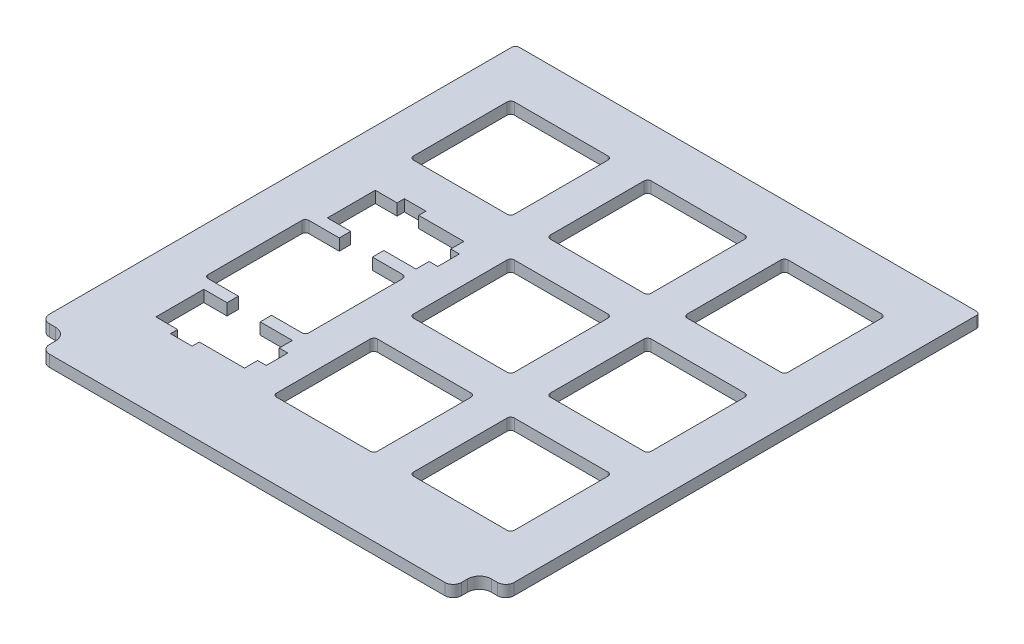
from build123d import *

# Parameters (mm, degrees)
EXTRUDE_1_DEPTH                = 1.6
CUT_EXTRUDE_1_REACH            = 82.345
SKETCH_2_W                     = 14
SKETCH_2_H                     = 14
FILLET_1_R                     = 0.5
PATTERN_LINEAR_2_COUNT         = 3
PATTERN_LINEAR_2_PITCH         = 19
PATTERN_LINEAR_2_COUNT_DIR2    = 3
PATTERN_LINEAR_2_PITCH_DIR2    = 19
FILLET_1_OF_PATTERN_LINEAR_2_R = 0.5
CUT_EXTRUDE_3_DEPTH            = 1.6
FILLET_2_R                     = 0.5


with BuildPart() as part:
    # 草图1 → 凸台-拉伸1 (new body)
    with BuildSketch(Plane(origin=(0, 0, 0), x_dir=(1, 0, 0), z_dir=(0, 1, 0))):
        with BuildLine():
            Line((-12.500806884, 61.22832279), (51.999193116, 61.22832279))
            Line((51.999193116, 61.22832279), (51.999193116, -3.47167721))
            ThreePointArc((51.999193116, -3.47167721), (51.662365914, -4.284850009), (50.849193116, -4.62167721))
            Line((50.849193116, -4.62167721), (49.999193116, -4.62167721))
            ThreePointArc((49.999193116, -4.62167721), (48.832466927, -5.104951021), (48.349193116, -6.27167721))
            Line((48.349193116, -6.27167721), (48.349193116, -7.12167721))
            ThreePointArc((48.349193116, -7.12167721), (48.012365914, -7.934850009), (47.199193116, -8.27167721))
            Line((47.199193116, -8.27167721), (-7.700806884, -8.27167721))
            ThreePointArc((-7.700806884, -8.27167721), (-8.513979683, -7.934850009), (-8.850806884, -7.12167721))
            Line((-8.850806884, -7.12167721), (-8.850806884, -6.27167721))
            ThreePointArc((-8.850806884, -6.27167721), (-9.334080695, -5.104951021), (-10.500806884, -4.62167721))
            Line((-10.500806884, -4.62167721), (-11.350806884, -4.62167721))
            ThreePointArc((-11.350806884, -4.62167721), (-12.163979683, -4.284850009), (-12.500806884, -3.47167721))
            Line((-12.500806884, -3.47167721), (-12.500806884, 61.22832279))
        make_face()
    extrude(amount=EXTRUDE_1_DEPTH)

    # 草图2 → 切除-拉伸1 (cut, up to next)
    with BuildSketch(Plane.XZ, mode=Mode.PRIVATE) as cut_extrude_1_sk1:
        with Locations((38.749193116, -9.315811453)):
            Rectangle(SKETCH_2_W, SKETCH_2_H)
    cut_extrude_1_tool1 = extrude(cut_extrude_1_sk1.sketch, amount=-CUT_EXTRUDE_1_REACH, mode=Mode.PRIVATE) & part.part
    cut_extrude_1 = cut_extrude_1_tool1.solids().sort_by_distance((38.749193, 0, -9.315811))[0]
    add(cut_extrude_1, mode=Mode.SUBTRACT)

    # 圆角1
    fillet_1_edges = [part.edges().sort_by_distance(p)[0] for p in [
        (31.749193116, 0.8, -16.315811453),
        (31.749193116, 0.8, -2.315811453),
        (45.749193116, 0.8, -2.315811453),
        (45.749193116, 0.8, -16.315811453),
    ]]
    fillet(fillet_1_edges, radius=FILLET_1_R)

    # 阵列(线性)2: Cut-Extrude 1 3 × 3, 2 skipped
    with Locations(*[(-j * PATTERN_LINEAR_2_PITCH_DIR2, 0, -i * PATTERN_LINEAR_2_PITCH) for i in range(PATTERN_LINEAR_2_COUNT) for j in range(PATTERN_LINEAR_2_COUNT_DIR2) if (i, j) not in ((0, 0), (0, 2), (1, 2))]):
        add(cut_extrude_1, mode=Mode.SUBTRACT)

    # 圆角1 of 阵列(线性)2
    fillet_1_of_pattern_linear_2_edges = [part.edges().sort_by_distance(p)[0] for p in [
        (12.749193116, 0.8, -16.315811453),
        (12.749193116, 0.8, -2.315811453),
        (26.749193116, 0.8, -2.315811453),
        (26.749193116, 0.8, -16.315811453),
        (31.749193116, 0.8, -35.315811453),
        (31.749193116, 0.8, -21.315811453),
        (45.749193116, 0.8, -21.315811453),
        (45.749193116, 0.8, -35.315811453),
        (12.749193116, 0.8, -35.315811453),
        (12.749193116, 0.8, -21.315811453),
        (26.749193116, 0.8, -21.315811453),
        (26.749193116, 0.8, -35.315811453),
        (31.749193116, 0.8, -54.315811453),
        (31.749193116, 0.8, -40.315811453),
        (45.749193116, 0.8, -40.315811453),
        (45.749193116, 0.8, -54.315811453),
        (12.749193116, 0.8, -54.315811453),
        (12.749193116, 0.8, -40.315811453),
        (26.749193116, 0.8, -40.315811453),
        (26.749193116, 0.8, -54.315811453),
        (-6.250806884, 0.8, -54.315811453),
        (-6.250806884, 0.8, -40.315811453),
        (7.749193116, 0.8, -40.315811453),
        (7.749193116, 0.8, -54.315811453),
    ]]
    fillet(fillet_1_of_pattern_linear_2_edges, radius=FILLET_1_OF_PATTERN_LINEAR_2_R)

    # 草图3 → 切除-拉伸3 (cut)
    with BuildSketch(Plane(origin=(0, 1.6, 0), x_dir=(1, 0, 0), z_dir=(0, 1, 0))):
        with BuildLine():
            Line((-6.250806884, 12.315811453), (-6.250806884, 25.315811453))
            ThreePointArc((-6.250806884, 25.315811453), (-6.104360275, 25.669364844), (-5.750806884, 25.815811453))
            Line((-5.750806884, 25.815811453), (-1.550806884, 25.815811453))
            Line((-1.550806884, 25.815811453), (-1.550806884, 27.395811453))
            Line((-1.550806884, 27.395811453), (-4.780806884, 27.395811453))
            Line((-4.780806884, 27.395811453), (-4.780806884, 34.045811453))
            Line((-4.780806884, 34.045811453), (-1.750806884, 34.045811453))
            Line((-1.750806884, 34.045811453), (-1.750806884, 35.045811453))
            Line((-1.750806884, 35.045811453), (1.249193116, 35.045811453))
            Line((1.249193116, 35.045811453), (1.249193116, 34.045811453))
            Line((1.249193116, 34.045811453), (7.519193116, 34.045811453))
            Line((7.519193116, 34.045811453), (7.519193116, 32.220811453))
            Line((7.519193116, 32.220811453), (8.719193116, 32.220811453))
            Line((8.719193116, 32.220811453), (8.719193116, 29.220811453))
            Line((8.719193116, 29.220811453), (7.519193116, 29.220811453))
            Line((7.519193116, 29.220811453), (7.519193116, 27.395811453))
            Line((7.519193116, 27.395811453), (3.049193116, 27.395811453))
            Line((3.049193116, 27.395811453), (3.049193116, 25.815811453))
            Line((3.049193116, 25.815811453), (7.249193116, 25.815811453))
            ThreePointArc((7.249193116, 25.815811453), (7.602746506, 25.669364844), (7.749193116, 25.315811453))
            Line((7.749193116, 25.315811453), (7.749193116, 12.315811453))
            ThreePointArc((7.749193116, 12.315811453), (7.602746506, 11.962258063), (7.249193116, 11.815811453))
            Line((7.249193116, 11.815811453), (3.049193116, 11.815811453))
            Line((3.049193116, 11.815811453), (3.049193116, 10.235811453))
            Line((3.049193116, 10.235811453), (7.519193116, 10.235811453))
            Line((7.519193116, 10.235811453), (7.519193116, 8.410811453))
            Line((7.519193116, 8.410811453), (8.719193116, 8.410811453))
            Line((8.719193116, 8.410811453), (8.719193116, 5.410811453))
            Line((8.719193116, 5.410811453), (7.519193116, 5.410811453))
            Line((7.519193116, 5.410811453), (7.519193116, 3.585811453))
            Line((7.519193116, 3.585811453), (1.249193116, 3.585811453))
            Line((1.249193116, 3.585811453), (1.249193116, 2.585811453))
            Line((1.249193116, 2.585811453), (-1.750806884, 2.585811453))
            Line((-1.750806884, 2.585811453), (-1.750806884, 3.585811453))
            Line((-1.750806884, 3.585811453), (-4.780806884, 3.585811453))
            Line((-4.780806884, 3.585811453), (-4.780806884, 10.235811453))
            Line((-4.780806884, 10.235811453), (-1.550806884, 10.235811453))
            Line((-1.550806884, 10.235811453), (-1.550806884, 11.815811453))
            Line((-1.550806884, 11.815811453), (-5.750806884, 11.815811453))
            ThreePointArc((-5.750806884, 11.815811453), (-6.104360275, 11.962258063), (-6.250806884, 12.315811453))
        make_face()
    extrude(amount=-CUT_EXTRUDE_3_DEPTH, mode=Mode.SUBTRACT)

    # 圆角2
    fillet_2_edges = [part.edges().sort_by_distance(p)[0] for p in [
        (-12.500806884, 0.8, -61.22832279),
        (51.999193116, 0.8, -61.22832279),
    ]]
    fillet(fillet_2_edges, radius=FILLET_2_R)


solid = part.part
